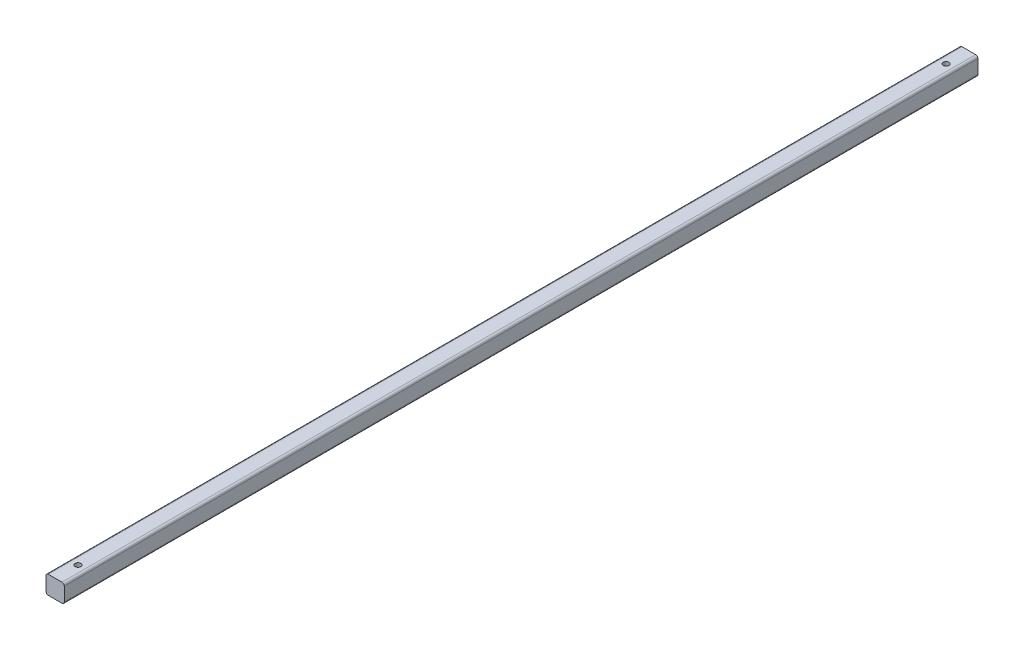
from build123d import *

# Parameters (mm, degrees)
SKETCH1_W                 = 4
SKETCH1_H                 = 4
BOSS_EXTRUDE1_DEPTH       = 100
FILLET1_R                 = 0.5
TAP_DRILL_FOR_M1_6_TAP1_D = 1.25


with BuildPart() as part:
    # Sketch1 → Boss-Extrude1 (new, symmetric)
    with BuildSketch(Plane.XY):
        Rectangle(SKETCH1_W, SKETCH1_H)
    extrude(amount=BOSS_EXTRUDE1_DEPTH, both=True)

    # Fillet1
    fillet1_edges = [part.edges().sort_by_distance(p)[0] for p in [
        (2, -2, 0),
        (-2, -2, 0),
        (2, 2, 0),
        (-2, 2, 0),
    ]]
    fillet(fillet1_edges, radius=FILLET1_R)

    # Tap Drill for M1.6 Tap1 (through all)
    with Locations(Plane(origin=(0, 2, -95), x_dir=(0, 0, 1), z_dir=(0, 1, 0))):
        with Locations((0, 0), (190, 0)):
            Hole(TAP_DRILL_FOR_M1_6_TAP1_D / 2)


solid = part.part
